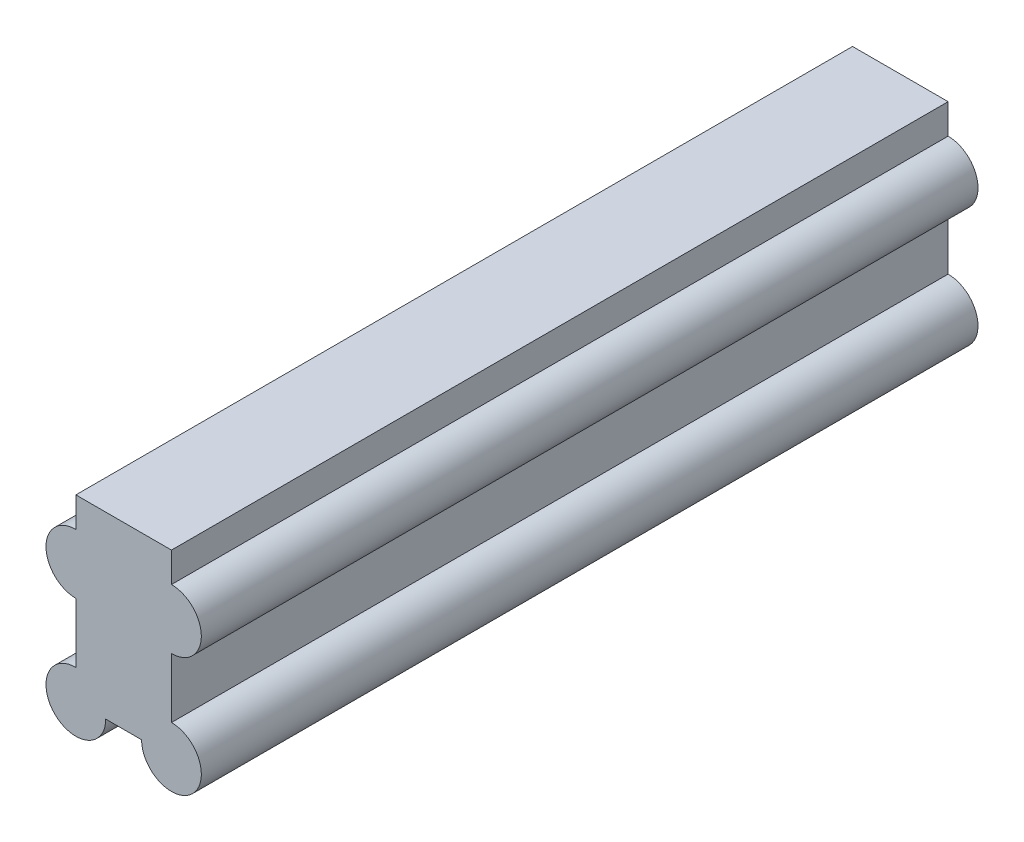
from build123d import *
from build123d.topology import SkipClean

# Parameters (mm, degrees)
SKETCH_1_R      = 5
SKETCH_1_W      = 16
SKETCH_1_H      = 30
EXTRUDE_1_DEPTH = 65


with BuildPart() as part:
    # Эскиз1 → Бобышка-Вытянуть1 (new, symmetric)
    with SkipClean():  # the faces are left unmerged after this step: merging them gives an invalid solid
        with BuildSketch(Plane(origin=(0, 0, 0), x_dir=(1, 0, 0), z_dir=(0, 0, -1))):
            with BuildLine():
                ThreePointArc((-8, 0), (-13, -5), (-8, -10))
                Line((-8, -10), (-8, 0))
            make_face()
            with BuildLine():
                Line((-8, 0), (-8, -10))
                ThreePointArc((-8, -10), (-4.464466094, -8.535533906), (-3, -5))
                ThreePointArc((-3, -5), (-4.464466094, -1.464466094), (-8, 0))
            make_face()
            with Locations((8, 15)):
                Circle(SKETCH_1_R)
            with Locations((8, -5)):
                Circle(SKETCH_1_R)
            with Locations((-8, -5)):
                Circle(SKETCH_1_R)
            with Locations((-8, 15)):
                Circle(SKETCH_1_R)
            Rectangle(SKETCH_1_W, SKETCH_1_H)
            with BuildLine():
                ThreePointArc((-3, 15), (-11.535533906, 18.535533906), (-8, 10))
                Line((-8, 10), (-8, 15))
                Line((-8, 15), (-3, 15))
            make_face()
            with BuildLine():
                Line((-8, 15), (-8, 10))
                ThreePointArc((-8, 10), (-4.464466094, 11.464466094), (-3, 15))
                Line((-3, 15), (-8, 15))
            make_face()
            with BuildLine():
                ThreePointArc((3, 15), (4.464466094, 11.464466094), (8, 10))
                Line((8, 10), (8, 15))
                Line((8, 15), (3, 15))
            make_face()
            with BuildLine():
                Line((8, 15), (8, 10))
                ThreePointArc((8, 10), (11.535533906, 11.464466094), (13, 15))
                ThreePointArc((13, 15), (8, 20), (3, 15))
                Line((3, 15), (8, 15))
            make_face()
            with BuildLine():
                ThreePointArc((8, 0), (3, -5), (8, -10))
                Line((8, -10), (8, 0))
            make_face()
            with BuildLine():
                Line((8, 0), (8, -10))
                ThreePointArc((8, -10), (11.535533906, -8.535533906), (13, -5))
                ThreePointArc((13, -5), (11.535533906, -1.464466094), (8, 0))
            make_face()
        extrude(amount=EXTRUDE_1_DEPTH, both=True)


solid = part.part
